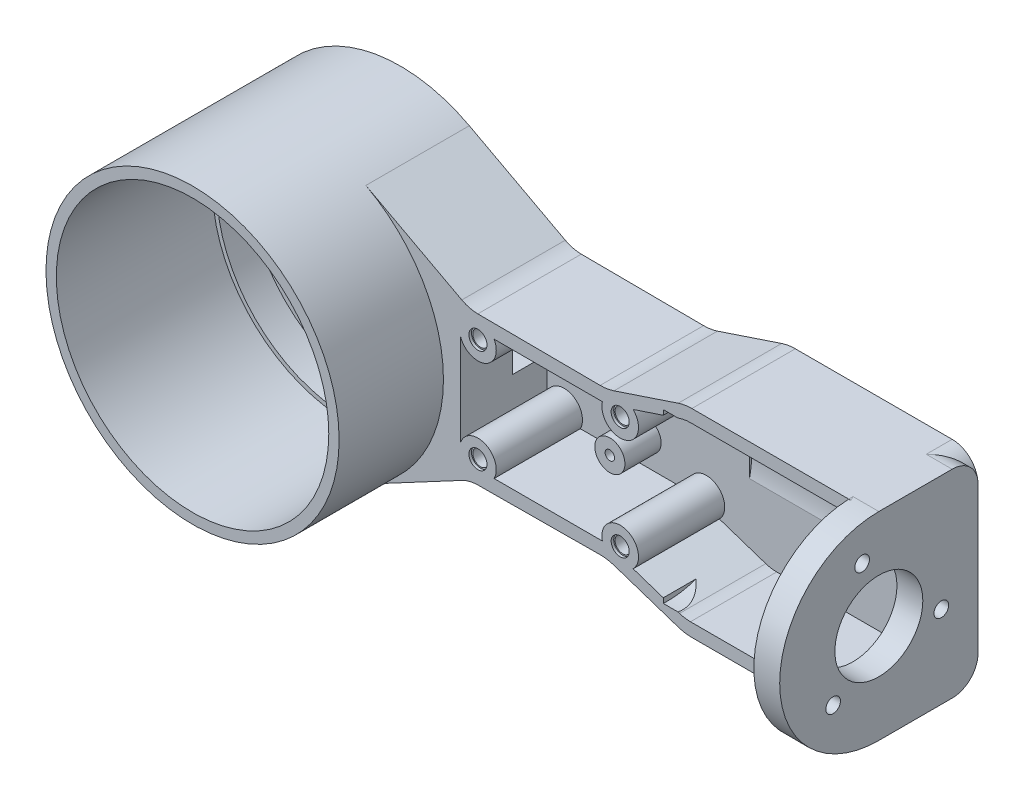
from build123d import *

# Parameters (mm, degrees)
SINGLE_FLAT_PRINT_FACE_ROOF_T4_DEPTH           = 4
SKETCH_2_R                                     = 34
MOTOR_ROOF_TOTAL_T5_DEPTH                      = 1
ARM_SHELL_BLANK_TOZ24_DEPTH                    = 20
SKETCH_4_R                                     = 30.6
ROTOR_CUP_ID61P2_ROOF_T5_DEPTH                 = 19
BOTTOM_SERVICE_BAY_ROOF_T4_DEPTH               = 20
SKETCH_6_R                                     = 34
SKETCH_6_R_2                                   = 30.6
ROTOR_WRAP_SKIRT_OD68_TOZ48P2_DEPTH            = 24.2
SKETCH_7_R                                     = 31.6
THIN_LOWER_SHROUD_T2P4_RADIAL_CLEARANCE1_DEPTH = 36.2
SKETCH_8_R                                     = 5
FOUR_MOTOR_MOUNT_BOSSES_TOZ12_DEPTH            = 7
STRAIGHT_SIX_D1_WIRE_CHANNEL_W6_H7_DEPTH       = 7
SKETCH_10_R                                    = 1.7
ROTOR_4XM3_PCD25_DEPTH                         = 12
SKETCH_11_R                                    = 3.15
TOP_FLUSH_MOTOR_HEAD_RECESS_D6P3_DEPTH3P_DEPTH = 3.6
DOWNWARD_ROUND_ENCODER_CARRIER_T6_DEPTH        = 6
CARRIER_WEB_23_DEPTH                           = 3
CARRIER_WEB_20_DEPTH                           = 3
SKETCH_15_R                                    = 10.2
SKETCH_15_R_2                                  = 1.7
ENCODER_PILOT_AND_3M3_ROTATED_MINUS45_DEPTH    = 6
SKETCH_16_R                                    = 19.5
ENCODER_BODY_D39_EXTENDED_INSERTION_RELI_DEPTH = 43
INTERNAL_CORNER_GLAND_AND_CABLE_POCKET_DEPTH   = 18
SKETCH_18_R                                    = 3.5
PCB_FIXED_TO_ARM_ROOF_TWO_D7_BOSSES_DEPTH      = 8.4
SKETCH_19_R                                    = 1.1
PCB_STANDOFF_M2_UPPER_SCREW_THROUGH_DEPTH      = 12.4
SKETCH_20_R                                    = 2.15
PCB_M2X12_HEAD_RECESS_FLUSH_PRINT_FACE_DEPTH   = 2.4
SKETCH_21_R                                    = 4.25
BOTTOM_COVER_FOUR_HEATSET_BOSSES_DEPTH         = 20
SKETCH_22_R                                    = 1.8
M3_OD4_L5_HEATSET_PILOT_D3P6_DEPTH5P4_DEPTH    = 5.4
SKETCH_23_R                                    = 2.1
M3_OD4_HEATSET_LEADIN_D4P2_DEPTH               = 0.6
SKETCH_24_R                                    = 1.7
M3_SCREW_TIP_RELIEF_DEPTH                      = 2.6


with BuildPart() as part:
    # 草图1 → Single_flat_print_face_roof_T4 (new body)
    with BuildSketch(Plane.XY):
        with BuildLine():
            Line((16, -30), (38.258713093, -18.12868635))
            ThreePointArc((38.258713093, -18.12868635), (40.058890241, -17.432471076), (41.973419952, -17.187666125))
            Line((41.973419952, -17.187666125), (70.345166821, -17.010342707))
            ThreePointArc((70.345166821, -17.010342707), (71.978634178, -17.134315399), (73.56994326, -17.52331442))
            Line((73.56994326, -17.52331442), (88.460498942, -22.486832981))
            ThreePointArc((88.460498942, -22.486832981), (90.020954172, -22.870874576), (91.622776602, -23))
            Line((91.622776602, -23), (128, -23))
            ThreePointArc((128, -23), (132.242640687, -21.242640687), (134, -17))
            Line((134, -17), (134, 17))
            ThreePointArc((134, 17), (132.242640687, 21.242640687), (128, 23))
            Line((128, 23), (91.622776602, 23))
            ThreePointArc((91.622776602, 23), (90.020954172, 22.870874576), (88.460498942, 22.486832981))
            Line((88.460498942, 22.486832981), (73.56994326, 17.52331442))
            ThreePointArc((73.56994326, 17.52331442), (71.978634178, 17.134315399), (70.345166821, 17.010342707))
            Line((70.345166821, 17.010342707), (41.973419952, 17.187666125))
            ThreePointArc((41.973419952, 17.187666125), (40.058890241, 17.432471076), (38.258713093, 18.12868635))
            Line((38.258713093, 18.12868635), (16, 30))
            ThreePointArc((16, 30), (-34, 0), (16, -30))
        make_face()
    extrude(amount=SINGLE_FLAT_PRINT_FACE_ROOF_T4_DEPTH)

    # 草图2 → Motor_roof_total_T5 (add)
    with BuildSketch(Plane.XY.offset(4)):
        with Locations(Location((0, 0, 0), (0, 0, 298.072486936))):
            Circle(SKETCH_2_R)
    extrude(amount=MOTOR_ROOF_TOTAL_T5_DEPTH)

    # 草图3 → Arm_shell_blank_toZ24 (add)
    with BuildSketch(Plane.XY.offset(4)):
        with BuildLine():
            Line((16, -30), (38.258713093, -18.12868635))
            ThreePointArc((38.258713093, -18.12868635), (40.058890241, -17.432471076), (41.973419952, -17.187666125))
            Line((41.973419952, -17.187666125), (70.345166821, -17.010342707))
            ThreePointArc((70.345166821, -17.010342707), (71.978634178, -17.134315399), (73.56994326, -17.52331442))
            Line((73.56994326, -17.52331442), (88.460498942, -22.486832981))
            ThreePointArc((88.460498942, -22.486832981), (90.020954172, -22.870874576), (91.622776602, -23))
            Line((91.622776602, -23), (128, -23))
            ThreePointArc((128, -23), (132.242640687, -21.242640687), (134, -17))
            Line((134, -17), (134, 17))
            ThreePointArc((134, 17), (132.242640687, 21.242640687), (128, 23))
            Line((128, 23), (91.622776602, 23))
            ThreePointArc((91.622776602, 23), (90.020954172, 22.870874576), (88.460498942, 22.486832981))
            Line((88.460498942, 22.486832981), (73.56994326, 17.52331442))
            ThreePointArc((73.56994326, 17.52331442), (71.978634178, 17.134315399), (70.345166821, 17.010342707))
            Line((70.345166821, 17.010342707), (41.973419952, 17.187666125))
            ThreePointArc((41.973419952, 17.187666125), (40.058890241, 17.432471076), (38.258713093, 18.12868635))
            Line((38.258713093, 18.12868635), (16, 30))
            ThreePointArc((16, 30), (-34, 0), (16, -30))
        make_face()
    extrude(amount=ARM_SHELL_BLANK_TOZ24_DEPTH)

    # 草图4 → Rotor_cup_ID61p2_roof_T5 (cut)
    with BuildSketch(Plane.XY.offset(24)):
        Circle(SKETCH_4_R)
    extrude(amount=-ROTOR_CUP_ID61P2_ROOF_T5_DEPTH, mode=Mode.SUBTRACT)

    # 草图5 → Bottom_service_bay_roof_T4 (cut)
    with BuildSketch(Plane.XY.offset(24)):
        with BuildLine():
            Line((41, -14), (70.701778719, -14))
            ThreePointArc((70.701778719, -14), (71.983236663, -14.103300339), (73.231600847, -14.410533616))
            Line((73.231600847, -14.410533616), (88.768399153, -19.589466384))
            ThreePointArc((88.768399153, -19.589466384), (90.016763337, -19.896699661), (91.298221281, -20))
            Line((91.298221281, -20), (125, -20))
            ThreePointArc((125, -20), (127.121320344, -19.121320344), (128, -17))
            Line((128, -17), (128, 17))
            ThreePointArc((128, 17), (127.121320344, 19.121320344), (125, 20))
            Line((125, 20), (91.298221281, 20))
            ThreePointArc((91.298221281, 20), (90.016763337, 19.896699661), (88.768399153, 19.589466384))
            Line((88.768399153, 19.589466384), (73.231600847, 14.410533616))
            ThreePointArc((73.231600847, 14.410533616), (71.983236663, 14.103300339), (70.701778719, 14))
            Line((70.701778719, 14), (41, 14))
            ThreePointArc((41, 14), (38.878679656, 13.121320344), (38, 11))
            Line((38, 11), (38, -11))
            ThreePointArc((38, -11), (38.878679656, -13.121320344), (41, -14))
        make_face()
    extrude(amount=-BOTTOM_SERVICE_BAY_ROOF_T4_DEPTH, mode=Mode.SUBTRACT)

    # 草图6 → Rotor_wrap_skirt_OD68_toZ48p2 (add)
    with BuildSketch(Plane.XY.offset(24)):
        with Locations(Location((0, 0, 0), (0, 0, 298.072486936))):
            Circle(SKETCH_6_R)
        Circle(SKETCH_6_R_2, mode=Mode.SUBTRACT)
    extrude(amount=ROTOR_WRAP_SKIRT_OD68_TOZ48P2_DEPTH)

    # 草图7 → Thin_lower_shroud_T2p4_radial_clearance1p8 (cut)
    with BuildSketch(Plane.XY.offset(48.2)):
        Circle(SKETCH_7_R)
    extrude(amount=-THIN_LOWER_SHROUD_T2P4_RADIAL_CLEARANCE1_DEPTH, mode=Mode.SUBTRACT)

    # 草图8 → Four_motor_mount_bosses_toZ12 (add)
    with BuildSketch(Plane.XY.offset(5)):
        with Locations((8.838834765, 8.838834765)):
            Circle(SKETCH_8_R)
        with Locations((-8.838834765, 8.838834765)):
            Circle(SKETCH_8_R)
        with Locations((-8.838834765, -8.838834765)):
            Circle(SKETCH_8_R)
        with Locations((8.838834765, -8.838834765)):
            Circle(SKETCH_8_R)
    extrude(amount=FOUR_MOTOR_MOUNT_BOSSES_TOZ12_DEPTH)

    # 草图9 → Straight_six_D1_wire_channel_W6_H7 (cut)
    with BuildSketch(Plane.XY.offset(12)):
        with BuildLine():
            Line((-2, -3), (42, -3))
            ThreePointArc((42, -3), (42.707106781, -2.707106781), (43, -2))
            Line((43, -2), (43, 2))
            ThreePointArc((43, 2), (42.707106781, 2.707106781), (42, 3))
            Line((42, 3), (-2, 3))
            ThreePointArc((-2, 3), (-2.707106781, 2.707106781), (-3, 2))
            Line((-3, 2), (-3, -2))
            ThreePointArc((-3, -2), (-2.707106781, -2.707106781), (-2, -3))
        make_face()
    extrude(amount=-STRAIGHT_SIX_D1_WIRE_CHANNEL_W6_H7_DEPTH, mode=Mode.SUBTRACT)

    # 草图10 → Rotor_4xM3_PCD25 (cut)
    with BuildSketch(Plane.XY.offset(12)):
        with Locations((8.838834765, 8.838834765)):
            Circle(SKETCH_10_R)
        with Locations((-8.838834765, 8.838834765)):
            Circle(SKETCH_10_R)
        with Locations((-8.838834765, -8.838834765)):
            Circle(SKETCH_10_R)
        with Locations((8.838834765, -8.838834765)):
            Circle(SKETCH_10_R)
    extrude(amount=-ROTOR_4XM3_PCD25_DEPTH, mode=Mode.SUBTRACT)

    # 草图11 → Top_flush_motor_head_recess_D6p3_depth3p6 (cut)
    with BuildSketch(Plane.XY):
        with Locations((8.838834765, 8.838834765)):
            Circle(SKETCH_11_R)
        with Locations((-8.838834765, 8.838834765)):
            Circle(SKETCH_11_R)
        with Locations((-8.838834765, -8.838834765)):
            Circle(SKETCH_11_R)
        with Locations((8.838834765, -8.838834765)):
            Circle(SKETCH_11_R)
    extrude(amount=TOP_FLUSH_MOTOR_HEAD_RECESS_D6P3_DEPTH3P_DEPTH, mode=Mode.SUBTRACT)

    # 草图12 → Downward_round_encoder_carrier_T6 (add)
    with BuildSketch(Plane(origin=(128, 0, 0), x_dir=(0, 0, -1), z_dir=(1, 0, 0))):
        with BuildLine():
            Line((0, -17), (0, 17))
            ThreePointArc((0, 17), (-1.757359313, 21.242640687), (-6, 23))
            Line((-6, 23), (-23, 23))
            ThreePointArc((-23, 23), (-46, 0), (-23, -23))
            Line((-23, -23), (-6, -23))
            ThreePointArc((-6, -23), (-1.757359313, -21.242640687), (0, -17))
        make_face()
    extrude(amount=DOWNWARD_ROUND_ENCODER_CARRIER_T6_DEPTH)

    # 草图13 → Carrier_web_-23 (add)
    with BuildSketch(Plane(origin=(0, -23, 0), x_dir=(1, 0, 0), z_dir=(0, 1, 0))):
        with BuildLine():
            Line((106, -4), (127, -4))
            ThreePointArc((127, -4), (127.707106781, -4.292893219), (128, -5))
            Line((128, -5), (128, -22))
            ThreePointArc((128, -22), (127.707106781, -22.707106781), (127, -23))
            Line((127, -23), (122.223536779, -23))
            ThreePointArc((122.223536779, -23), (122.005383968, -22.975914623), (121.797739742, -22.904818702))
            Line((121.797739742, -22.904818702), (105.574202964, -15.270213159))
            ThreePointArc((105.574202964, -15.270213159), (105.15566682, -14.901212973), (105, -14.365394457))
            Line((105, -14.365394457), (105, -5))
            ThreePointArc((105, -5), (105.292893219, -4.292893219), (106, -4))
        make_face()
    extrude(amount=CARRIER_WEB_23_DEPTH)

    # 草图14 → Carrier_web_20 (add)
    with BuildSketch(Plane(origin=(0, 20, 0), x_dir=(1, 0, 0), z_dir=(0, 1, 0))):
        with BuildLine():
            Line((106, -4), (127, -4))
            ThreePointArc((127, -4), (127.707106781, -4.292893219), (128, -5))
            Line((128, -5), (128, -22))
            ThreePointArc((128, -22), (127.707106781, -22.707106781), (127, -23))
            Line((127, -23), (122.223536779, -23))
            ThreePointArc((122.223536779, -23), (122.005383968, -22.975914623), (121.797739742, -22.904818702))
            Line((121.797739742, -22.904818702), (105.574202964, -15.270213159))
            ThreePointArc((105.574202964, -15.270213159), (105.15566682, -14.901212973), (105, -14.365394457))
            Line((105, -14.365394457), (105, -5))
            ThreePointArc((105, -5), (105.292893219, -4.292893219), (106, -4))
        make_face()
    extrude(amount=CARRIER_WEB_20_DEPTH)

    # 草图15 → Encoder_pilot_and_3M3_rotated_minus45 (cut)
    with BuildSketch(Plane(origin=(134, 0, 0), x_dir=(0, 0, -1), z_dir=(1, 0, 0))):
        with Locations((-23, 0)):
            Circle(SKETCH_15_R)
        with Locations((-33.606601718, -10.606601718)):
            Circle(SKETCH_15_R_2)
        with Locations((-8.511112606, -3.882285677)):
            Circle(SKETCH_15_R_2)
        with Locations((-26.882285677, 14.488887394)):
            Circle(SKETCH_15_R_2)
    extrude(amount=-ENCODER_PILOT_AND_3M3_ROTATED_MINUS45_DEPTH, mode=Mode.SUBTRACT)

    # 草图16 → Encoder_body_D39_extended_insertion_relief (cut)
    with BuildSketch(Plane(origin=(128, 0, 0), x_dir=(0, 0, -1), z_dir=(1, 0, 0))):
        with Locations((-23, 0)):
            Circle(SKETCH_16_R)
    extrude(amount=-ENCODER_BODY_D39_EXTENDED_INSERTION_RELI_DEPTH, mode=Mode.SUBTRACT)

    # 草图17 → Internal_corner_gland_and_cable_pocket (cut)
    with BuildSketch(Plane(origin=(110, 0, 0), x_dir=(0, 0, -1), z_dir=(1, 0, 0))):
        with BuildLine():
            Line((-3, 9), (-3, 19))
            ThreePointArc((-3, 19), (-3.585786438, 20.414213562), (-5, 21))
            Line((-5, 21), (-18, 21))
            ThreePointArc((-18, 21), (-19.414213562, 20.414213562), (-20, 19))
            Line((-20, 19), (-20, 9))
            ThreePointArc((-20, 9), (-19.414213562, 7.585786438), (-18, 7))
            Line((-18, 7), (-5, 7))
            ThreePointArc((-5, 7), (-3.585786438, 7.585786438), (-3, 9))
        make_face()
    extrude(amount=-INTERNAL_CORNER_GLAND_AND_CABLE_POCKET_DEPTH, mode=Mode.SUBTRACT)

    # 草图18 → PCB_fixed_to_arm_roof_two_D7_bosses (add)
    with BuildSketch(Plane.XY.offset(4)):
        with Locations((61, -7.5)):
            Circle(SKETCH_18_R)
        with Locations((61, 7.5)):
            Circle(SKETCH_18_R)
    extrude(amount=PCB_FIXED_TO_ARM_ROOF_TWO_D7_BOSSES_DEPTH)

    # 草图19 → PCB_standoff_M2_upper_screw_through (cut)
    with BuildSketch(Plane.XY.offset(12.4)):
        with Locations((61, -7.5)):
            Circle(SKETCH_19_R)
        with Locations((61, 7.5)):
            Circle(SKETCH_19_R)
    extrude(amount=-PCB_STANDOFF_M2_UPPER_SCREW_THROUGH_DEPTH, mode=Mode.SUBTRACT)

    # 草图20 → PCB_M2x12_head_recess_flush_print_face (cut)
    with BuildSketch(Plane.XY):
        with Locations((61, -7.5)):
            Circle(SKETCH_20_R)
        with Locations((61, 7.5)):
            Circle(SKETCH_20_R)
    extrude(amount=PCB_M2X12_HEAD_RECESS_FLUSH_PRINT_FACE_DEPTH, mode=Mode.SUBTRACT)

    # 草图21 → Bottom_cover_four_heatset_bosses (add)
    with BuildSketch(Plane.XY.offset(4)):
        with Locations((42, -12)):
            Circle(SKETCH_21_R)
        with Locations((42, 12)):
            Circle(SKETCH_21_R)
        with Locations((75, -13)):
            Circle(SKETCH_21_R)
        with Locations((75, 13)):
            Circle(SKETCH_21_R)
    extrude(amount=BOTTOM_COVER_FOUR_HEATSET_BOSSES_DEPTH)

    # 草图22 → M3_OD4_L5_heatset_pilot_D3p6_depth5p4 (cut)
    with BuildSketch(Plane.XY.offset(24)):
        with Locations((42, -12)):
            Circle(SKETCH_22_R)
        with Locations((42, 12)):
            Circle(SKETCH_22_R)
        with Locations((75, -13)):
            Circle(SKETCH_22_R)
        with Locations((75, 13)):
            Circle(SKETCH_22_R)
    extrude(amount=-M3_OD4_L5_HEATSET_PILOT_D3P6_DEPTH5P4_DEPTH, mode=Mode.SUBTRACT)

    # 草图23 → M3_OD4_heatset_leadin_D4p2 (cut)
    with BuildSketch(Plane.XY.offset(24)):
        with Locations((42, -12)):
            Circle(SKETCH_23_R)
        with Locations((42, 12)):
            Circle(SKETCH_23_R)
        with Locations((75, -13)):
            Circle(SKETCH_23_R)
        with Locations((75, 13)):
            Circle(SKETCH_23_R)
    extrude(amount=-M3_OD4_HEATSET_LEADIN_D4P2_DEPTH, mode=Mode.SUBTRACT)

    # 草图24 → M3_screw_tip_relief (cut)
    with BuildSketch(Plane.XY.offset(18.6)):
        with Locations((42, -12)):
            Circle(SKETCH_24_R)
        with Locations((42, 12)):
            Circle(SKETCH_24_R)
        with Locations((75, -13)):
            Circle(SKETCH_24_R)
        with Locations((75, 13)):
            Circle(SKETCH_24_R)
    extrude(amount=-M3_SCREW_TIP_RELIEF_DEPTH, mode=Mode.SUBTRACT)


solid = part.part
